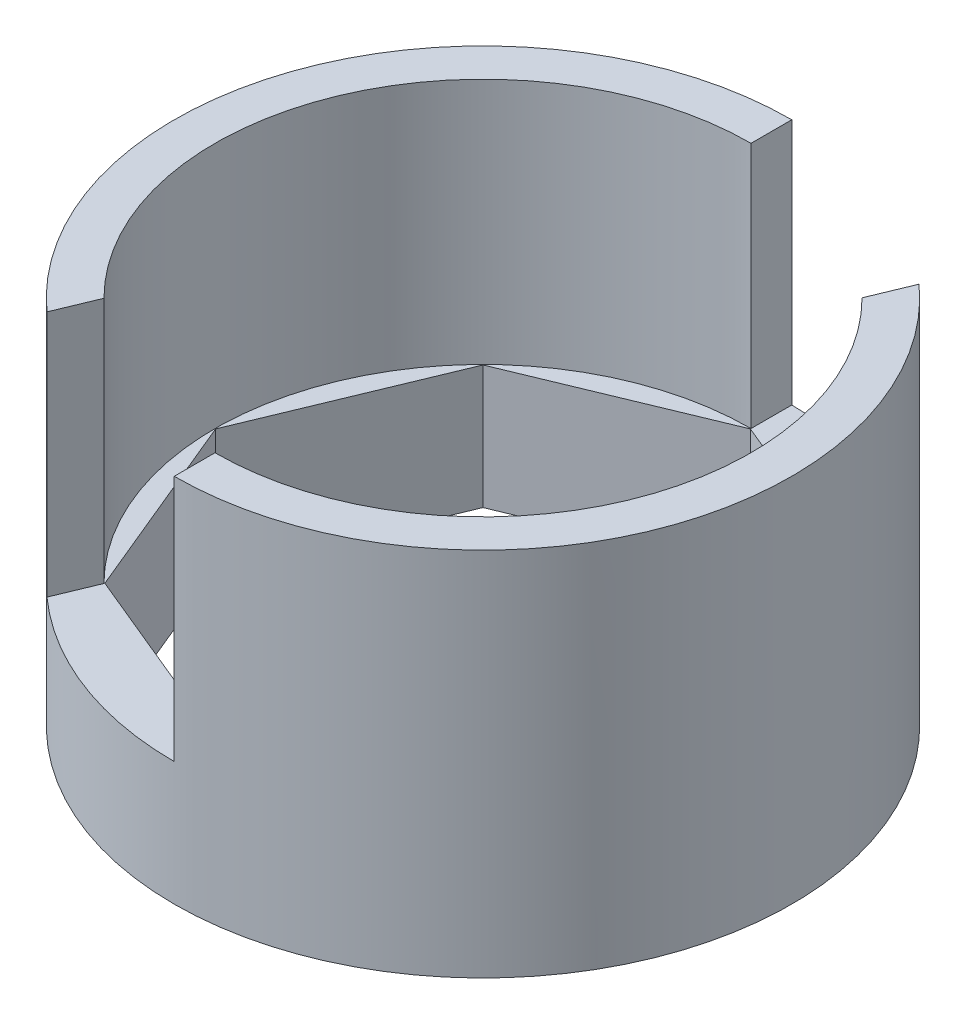
from build123d import *

# Parameters (mm, degrees)
SKETCH1_R           = 12.5
BOSS_EXTRUDE1_DEPTH = 5
BOSS_EXTRUDE3_DEPTH = 10


with BuildPart() as part:
    # Sketch1 → Boss-Extrude1 (new body)
    with BuildSketch(Plane(origin=(0, 0, 0), x_dir=(1, 0, 0), z_dir=(0, 1, 0))):
        with Locations(Location((0, 0, 0), (0, 0, 270))):
            Circle(SKETCH1_R)
        Polygon((10.823922003, 0), (7.653668647, 7.653668647), (0, 10.823922003), (-7.653668647, 7.653668647), (-10.823922003, 0), (-7.653668647, -7.653668647), (0, -10.823922003), (7.653668647, -7.653668647), align=None, mode=Mode.SUBTRACT)
    extrude(amount=BOSS_EXTRUDE1_DEPTH)

    # Sketch2 → Boss-Extrude3 (add)
    with BuildSketch(Plane(origin=(0, 5, 0), x_dir=(1, 0, 0), z_dir=(0, 1, 0))):
        with BuildLine():
            Line((-8.340109868, -9.310884351), (-7.664468281, -7.67974127))
            ThreePointArc((-7.664468281, -7.67974127), (-10.026158107, 4.147125946), (0, 10.85))
            Line((0, 10.85), (0, 12.5))
            ThreePointArc((0, 12.5), (-11.675531131, 4.464523805), (-8.340109868, -9.310884351))
        make_face()
        with BuildLine():
            ThreePointArc((10.85, 0), (7.672108576, -7.672108576), (0, -10.85))
            Line((0, -10.85), (0, -12.5))
            ThreePointArc((0, -12.5), (8.838834765, -8.838834765), (12.5, 0))
            ThreePointArc((12.5, 0), (11.412549003, 5.099384792), (8.339403959, 9.311516612))
            Line((8.339403959, 9.311516612), (7.664457508, 7.679752021))
            ThreePointArc((7.664457508, 7.679752021), (10.02202235, 4.157110537), (10.85, 0))
        make_face()
    extrude(amount=BOSS_EXTRUDE3_DEPTH)


solid = part.part
